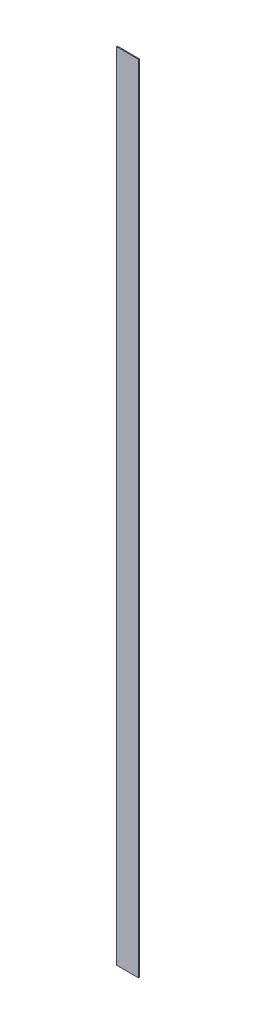
from build123d import *

# Parameters (mm, degrees)
SKETCH_1_W      = 50
SKETCH_1_H      = 1780
EXTRUDE_1_DEPTH = 1


with BuildPart() as part:
    # Эскиз1 → Бобышка-Вытянуть1 (new, symmetric)
    with BuildSketch(Plane.XY):
        Rectangle(SKETCH_1_W, SKETCH_1_H)
    extrude(amount=EXTRUDE_1_DEPTH, both=True)


solid = part.part
